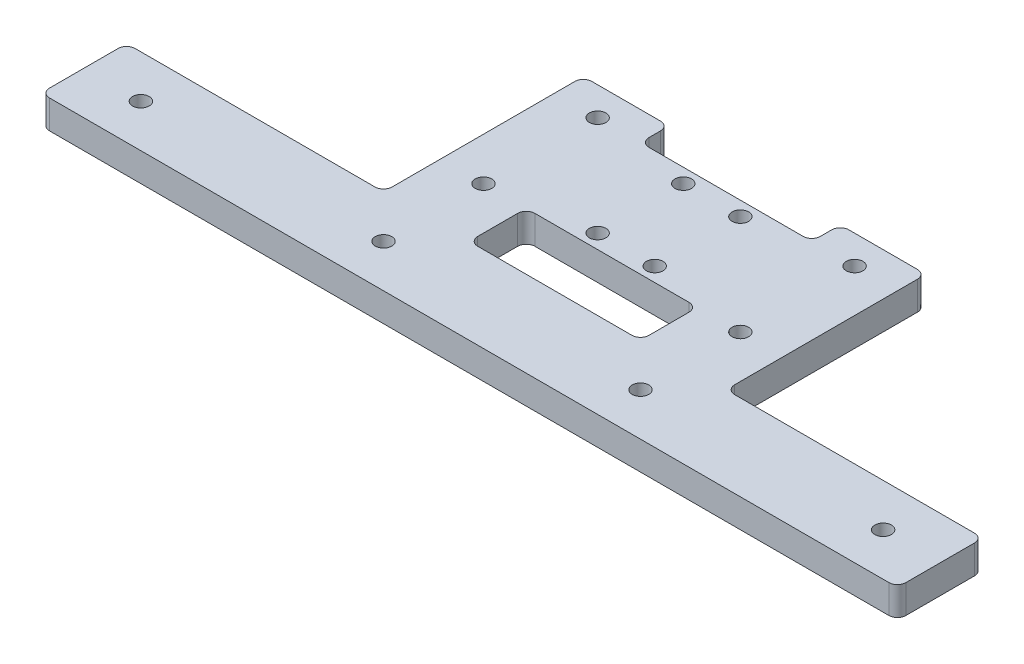
from build123d import *

# Parameters (mm, degrees)
SKETCH_1_W          = 30
SKETCH_1_H          = 20
EXTRUDE_1_DEPTH     = 5
SKETCH_2_R          = 1.45
CUT_EXTRUDE_1_DEPTH = 19.708286934
SKETCH_3_W          = 15
SKETCH_3_H          = 30
SKETCH_3_R          = 1.45
EXTRUDE_2_DEPTH     = 5
SKETCH_6_W          = 15
SKETCH_6_H          = 5
EXTRUDE_4_DEPTH     = 5
SKETCH_4_R          = 1.45
EXTRUDE_3_DEPTH     = 5
FILLET_2_R          = 1.5


with BuildPart() as part:
    # 草图1 → 凸台-拉伸1 (new body)
    with BuildSketch(Plane(origin=(0, 0, 0), x_dir=(1, 0, 0), z_dir=(0, 1, 0))):
        Rectangle(SKETCH_1_W, SKETCH_1_H)
    extrude(amount=EXTRUDE_1_DEPTH)

    # 草图2 → 切除-拉伸1 (cut, through all)
    with BuildSketch(Plane(origin=(0, 5, 0), x_dir=(1, 0, 0), z_dir=(0, 1, 0))):
        with Locations(Location((-5, 7.5, 0), (0, 0, 270))):
            Circle(SKETCH_2_R)
        with Locations(Location((5, 7.5, 0), (0, 0, 270))):
            Circle(SKETCH_2_R)
        with Locations(Location((5, -7.5, 0), (0, 0, 270))):
            Circle(SKETCH_2_R)
        with Locations(Location((-5, -7.5, 0), (0, 0, 270))):
            Circle(SKETCH_2_R)
    extrude(amount=-CUT_EXTRUDE_1_DEPTH, mode=Mode.SUBTRACT)

    # 草图3 → 凸台-拉伸2 (add)
    # profile 1 of 2: a face of its own
    with BuildSketch(Plane(origin=(0, 5, 0), x_dir=(1, 0, 0), z_dir=(0, 1, 0))):
        with Locations((22.5, 0)):
            Rectangle(SKETCH_3_W, SKETCH_3_H)
        with Locations(Location((22.5, -10, 0), (0, 0, 90))):
            Circle(SKETCH_3_R, mode=Mode.SUBTRACT)
        with Locations(Location((22.5, 10, 0), (0, 0, 90))):
            Circle(SKETCH_3_R, mode=Mode.SUBTRACT)
    # profile 2 of 2: a face of its own
    with BuildSketch(Plane(origin=(0, 5, 0), x_dir=(1, 0, 0), z_dir=(0, 1, 0))):
        with Locations((-22.5, 0)):
            Rectangle(SKETCH_3_W, SKETCH_3_H)
        with Locations(Location((-22.5, 10, 0), (0, 0, 270))):
            Circle(SKETCH_3_R, mode=Mode.SUBTRACT)
        with Locations(Location((-22.5, -10, 0), (0, 0, 270))):
            Circle(SKETCH_3_R, mode=Mode.SUBTRACT)
    extrude(amount=-EXTRUDE_2_DEPTH)

    # 草图6 → 凸台-拉伸4 (add)
    with BuildSketch(Plane(origin=(0, 5, 0), x_dir=(1, 0, 0), z_dir=(0, 1, 0))):
        with Locations((-22.5, -17.5)):
            Rectangle(SKETCH_6_W, SKETCH_6_H)
        with Locations((22.5, -17.5)):
            Rectangle(SKETCH_6_W, SKETCH_6_H)
    extrude(amount=-EXTRUDE_4_DEPTH)

    # 草图4 → 凸台-拉伸3 (add)
    with BuildSketch(Plane(origin=(0, 5, 0), x_dir=(1, 0, 0), z_dir=(0, 1, 0))):
        Polygon((-30, -20), (-75, -20), (-75, -35), (75, -35), (75, -20), (30, -20), (15, -20), (-15, -20), align=None)
        with Locations(Location((-65, -27.5, 0), (0, 0, 270))):
            Circle(SKETCH_4_R, mode=Mode.SUBTRACT)
        with Locations(Location((-22.5, -27.5, 0), (0, 0, 270))):
            Circle(SKETCH_4_R, mode=Mode.SUBTRACT)
        with Locations(Location((22.5, -27.5, 0), (0, 0, 270))):
            Circle(SKETCH_4_R, mode=Mode.SUBTRACT)
        with Locations(Location((65, -27.5, 0), (0, 0, 270))):
            Circle(SKETCH_4_R, mode=Mode.SUBTRACT)
    extrude(amount=-EXTRUDE_3_DEPTH)

    # 圆角2
    fillet_2_edges = [part.edges().sort_by_distance(p)[0] for p in [
        (15, 2.5, -15),
        (30, 2.5, -15),
        (-15, 2.5, -15),
        (-30, 2.5, -15),
        (-15, 2.5, 20),
        (-30, 2.5, 20),
        (15, 2.5, 10),
        (30, 2.5, 20),
        (-15, 2.5, 10),
        (15, 2.5, 20),
        (-15, 2.5, -10),
        (15, 2.5, -10),
        (-75, 2.5, 20),
        (-75, 2.5, 35),
        (75, 2.5, 35),
        (75, 2.5, 20),
    ]]
    fillet(fillet_2_edges, radius=FILLET_2_R)


solid = part.part
